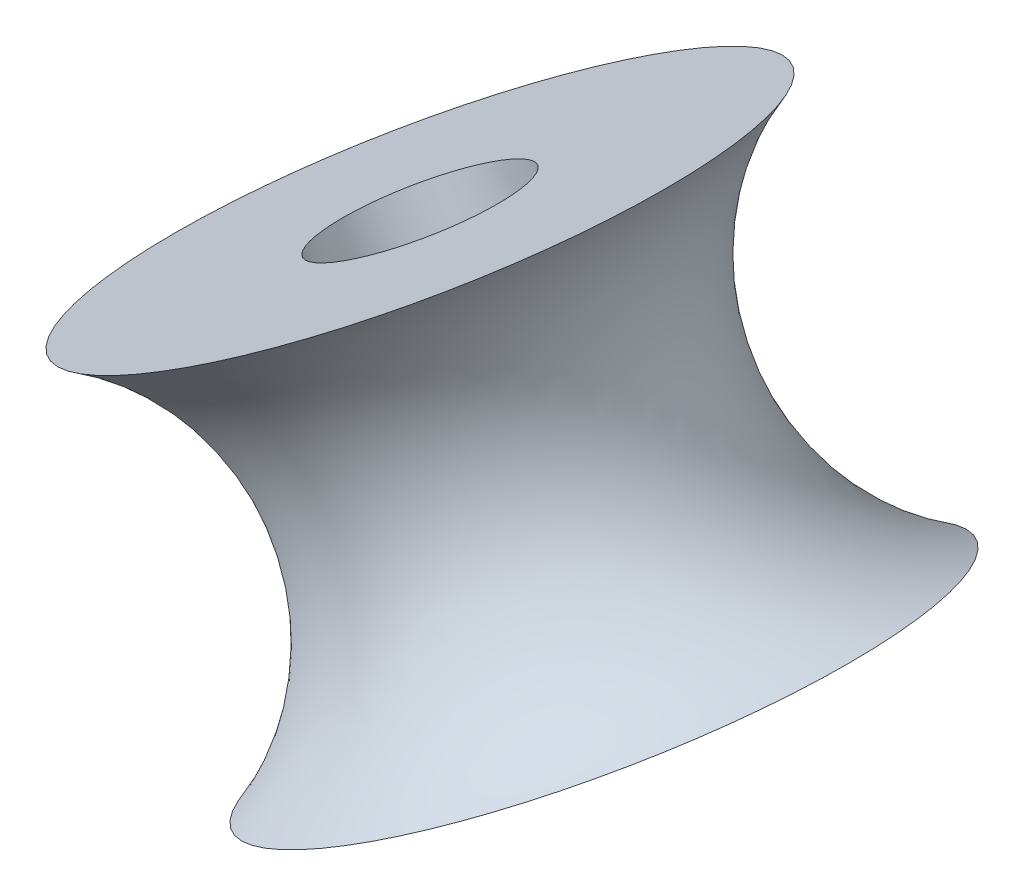
from build123d import *


with BuildPart() as part:
    # Sketch1 → Revolve2 (revolve)
    with BuildSketch(Plane.XY, mode=Mode.PRIVATE) as revolve2_sk:
        with BuildLine():
            Line((-0.42333395, 5.93323591), (4.92666605, -3.33323591))
            Line((4.92666605, -3.33323591), (9.797119576, -0.521278256))
            ThreePointArc((9.797119576, -0.521278256), (4.58512091, 2.647220792), (4.447119576, 8.745193564))
            Line((4.447119576, 8.745193564), (-0.42333395, 5.93323591))
        make_face()
    revolve(revolve2_sk.sketch.rotate(Axis((-2.675, 4.63323591, 0), (0.5000000000000001, -0.8660254037844387, 0)), 180), axis=Axis((-2.675, 4.63323591, 0), (0.5000000000000001, -0.8660254037844387, 0)))


solid = part.part
